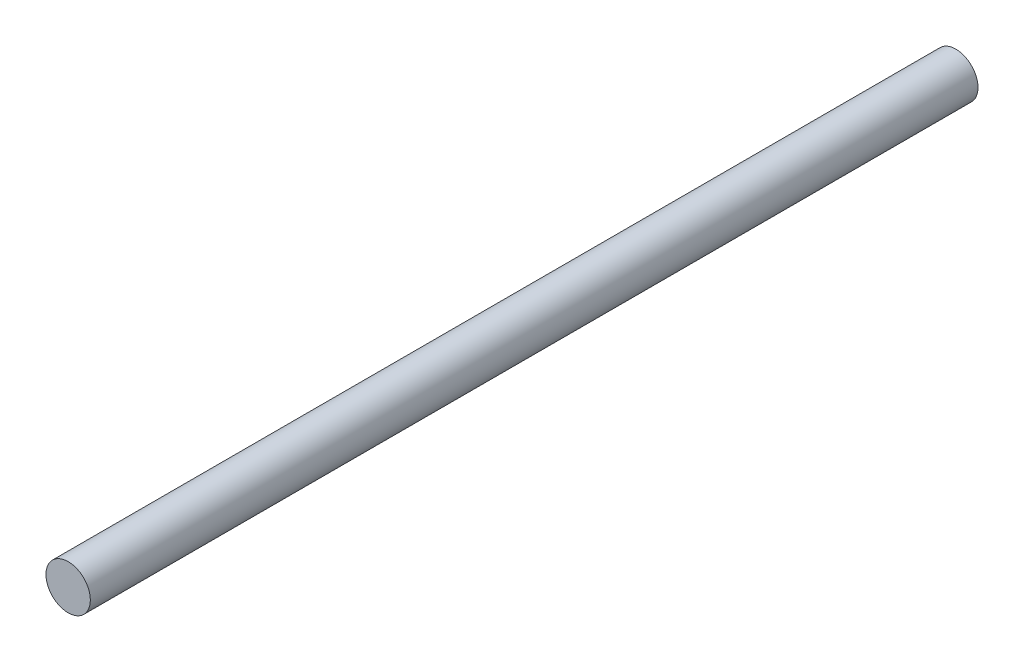
from build123d import *

# Parameters (mm, degrees)
CROQUIS1_R              = 2.5
SALIENTE_EXTRUIR1_DEPTH = 100


with BuildPart() as part:
    # Croquis1 → Saliente-Extruir1 (new body)
    with BuildSketch(Plane.XY):
        Circle(CROQUIS1_R)
    extrude(amount=SALIENTE_EXTRUIR1_DEPTH)


solid = part.part
